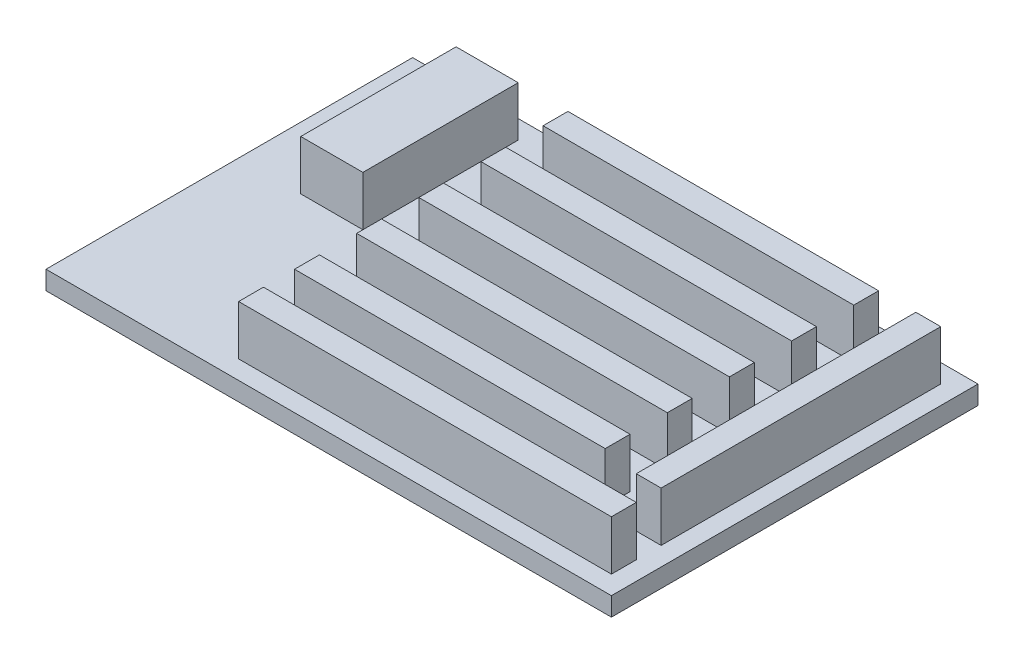
from build123d import *

# Parameters (mm, degrees)
SKETCH1_W           = 91
SKETCH1_H           = 59
BOSS_EXTRUDE1_DEPTH = 3
SKETCH2_W           = 10
SKETCH2_H           = 25
SKETCH2_W_2         = 50
SKETCH2_H_2         = 4
SKETCH2_W_3         = 4
SKETCH2_H_3         = 45
SKETCH2_W_4         = 60
BOSS_EXTRUDE2_DEPTH = 8


with BuildPart() as part:
    # Sketch1 → Boss-Extrude1 (new body)
    with BuildSketch(Plane(origin=(0, 0, 0), x_dir=(1, 0, 0), z_dir=(0, 1, 0))):
        with Locations((45.5, 29.5)):
            Rectangle(SKETCH1_W, SKETCH1_H)
    extrude(amount=BOSS_EXTRUDE1_DEPTH)

    # Sketch2 → Boss-Extrude2 (add)
    with BuildSketch(Plane(origin=(0, 3, 0), x_dir=(1, 0, 0), z_dir=(0, 1, 0))):
        with Locations((15, 43.5)):
            Rectangle(SKETCH2_W, SKETCH2_H)
        with Locations((53, 54)):
            Rectangle(SKETCH2_W_2, SKETCH2_H_2)
        with Locations((86, 33.5)):
            Rectangle(SKETCH2_W_3, SKETCH2_H_3)
        with Locations((58, 5)):
            Rectangle(SKETCH2_W_4, SKETCH2_H_2)
        with Locations((53, 44)):
            Rectangle(SKETCH2_W_2, SKETCH2_H_2)
        with Locations((53, 34)):
            Rectangle(SKETCH2_W_2, SKETCH2_H_2)
        with Locations((53, 24)):
            Rectangle(SKETCH2_W_2, SKETCH2_H_2)
        with Locations((53, 14)):
            Rectangle(SKETCH2_W_2, SKETCH2_H_2)
    extrude(amount=BOSS_EXTRUDE2_DEPTH)


solid = part.part
